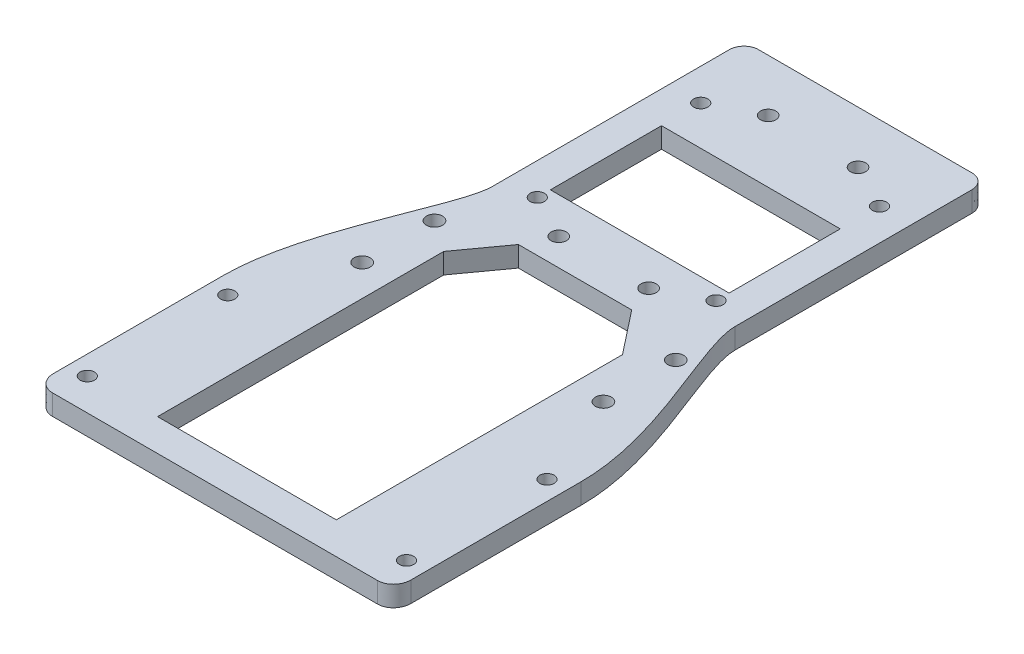
from build123d import *

# Parameters (mm, degrees)
SKETCH1_R           = 2.000308567
SKETCH1_R_2         = 2.000222439
SKETCH1_R_3         = 1.777841526
SKETCH1_R_4         = 1.904793294
SKETCH1_R_5         = 1.777669271
SKETCH1_R_6         = 1.777927653
SKETCH1_R_7         = 1.904965549
SKETCH1_R_8         = 1.77801378
SKETCH1_W           = 44.45
SKETCH1_H           = 27.635522461
BOSS_EXTRUDE2_DEPTH = 5.08


with BuildPart() as part:
    # Sketch1 → Boss-Extrude2 (new body)
    with BuildSketch(Plane(origin=(0, 0, 0), x_dir=(1, 0, 0), z_dir=(0, 1, 0))):
        with BuildLine():
            Line((-201.612672255, -11.699372016), (-201.612672255, 47.168869358))
            add(Edge.make_bspline(
                [(-201.612672255, 47.168869358), (-201.612672255, 49.174431695), (-199.986931695, 50.8), (-197.981369358, 50.8)],
                knots=[1, 1, 1, 1, 2, 2, 2, 2], degree=3))
            Line((-197.981369358, 50.8), (-144.918975152, 50.8))
            add(Edge.make_bspline(
                [(-144.918975152, 50.8), (-142.913585069, 50.8), (-141.2875, 49.174431695), (-141.2875, 47.168869358)],
                knots=[3, 3, 3, 3, 4, 4, 4, 4], degree=3))
            Line((-141.2875, 47.168869358), (-141.2875, -11.699372016))
            add(Edge.make_bspline(
                [(-141.2875, -11.699372016), (-141.2875, -20.416152615), (-127, -44.166985406), (-127, -64.33991428)],
                knots=[5, 5, 5, 5, 6, 6, 6, 6], degree=3))
            Line((-127, -64.33991428), (-127, -106.638107639))
            add(Edge.make_bspline(
                [(-127, -106.638107639), (-127, -108.986284722), (-128.800062391, -110.889355469), (-131.020426432, -110.889355469)],
                knots=[7, 7, 7, 7, 8, 8, 8, 8], degree=3))
            Line((-131.020426432, -110.889355469), (-211.879229058, -110.889355469))
            add(Edge.make_bspline(
                [(-211.879229058, -110.889355469), (-214.099765354, -110.889355469), (-215.9, -108.986284722), (-215.9, -106.638107639)],
                knots=[9, 9, 9, 9, 10, 10, 10, 10], degree=3))
            Line((-215.9, -106.638107639), (-215.9, -64.33991428))
            add(Edge.make_bspline(
                [(-215.9, -64.33991428), (-215.9, -44.166985406), (-201.612672255, -20.416152615), (-201.612672255, -11.699372016)],
                knots=[11, 11, 11, 11, 12, 12, 12, 12], degree=3))
        make_face()
        with Locations(Location((-201.447479926, -44.309353977, 0), (0, 0, 270))):
            Circle(SKETCH1_R, mode=Mode.SUBTRACT)
        with Locations(Location((-141.452864583, -44.309353977, 0), (0, 0, 270))):
            Circle(SKETCH1_R, mode=Mode.SUBTRACT)
        with Locations(Location((-141.452864583, -26.325869412, 0), (0, 0, 270))):
            Circle(SKETCH1_R_2, mode=Mode.SUBTRACT)
        with Locations(Location((-193.675, -8.524372016, 0), (0, 0, 270))):
            Circle(SKETCH1_R_3, mode=Mode.SUBTRACT)
        with Locations(Location((-160.274110243, -14.239440918, 0), (0, 0, 270))):
            Circle(SKETCH1_R_4, mode=Mode.SUBTRACT)
        with Locations(Location((-149.225, -8.524372016, 0), (0, 0, 270))):
            Circle(SKETCH1_R_5, mode=Mode.SUBTRACT)
        with Locations(Location((-193.674913873, 32.115696886, 0), (0, 0, 270))):
            Circle(SKETCH1_R_6, mode=Mode.SUBTRACT)
        with Locations(Location((-182.626062012, 37.830765788, 0), (0, 0, 270))):
            Circle(SKETCH1_R_7, mode=Mode.SUBTRACT)
        with Locations(Location((-160.273937988, 37.830765788, 0), (0, 0, 270))):
            Circle(SKETCH1_R_7, mode=Mode.SUBTRACT)
        with Locations(Location((-149.225, 32.115696886, 0), (0, 0, 270))):
            Circle(SKETCH1_R_5, mode=Mode.SUBTRACT)
        with Locations(Location((-182.626062012, -14.239440918, 0), (0, 0, 270))):
            Circle(SKETCH1_R_7, mode=Mode.SUBTRACT)
        with Locations(Location((-201.447479926, -26.325869412, 0), (0, 0, 270))):
            Circle(SKETCH1_R_2, mode=Mode.SUBTRACT)
        with Locations(Location((-211.1375, -68.026510959, 0), (0, 0, 270))):
            Circle(SKETCH1_R_8, mode=Mode.SUBTRACT)
        with Locations(Location((-131.7625, -102.951510959, 0), (0, 0, 270))):
            Circle(SKETCH1_R_8, mode=Mode.SUBTRACT)
        with Locations(Location((-211.1375, -102.951510959, 0), (0, 0, 270))):
            Circle(SKETCH1_R_8, mode=Mode.SUBTRACT)
        with Locations(Location((-131.7625, -68.026510959, 0), (0, 0, 270))):
            Circle(SKETCH1_R_8, mode=Mode.SUBTRACT)
        Polygon((-193.675, -102.951855469), (-193.675, -31.789790853), (-185.880299208, -21.022144911), (-157.698901367, -21.022144911), (-149.225, -31.789790853), (-149.225, -102.951855469), align=None, mode=Mode.SUBTRACT)
        with Locations((-171.45, 8.542458768)):
            Rectangle(SKETCH1_W, SKETCH1_H, mode=Mode.SUBTRACT)
    extrude(amount=BOSS_EXTRUDE2_DEPTH)


solid = part.part
